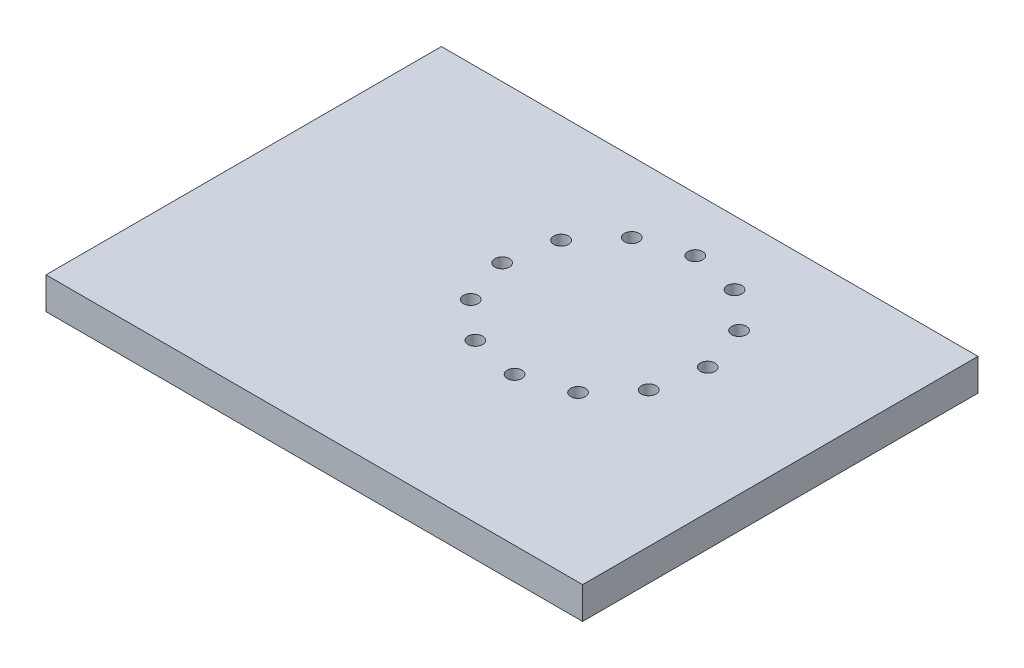
from build123d import *

# Parameters (mm, degrees)
SKETCH1_W           = 241.3
SKETCH1_H           = 177.8
BOSS_EXTRUDE1_DEPTH = 14.351
SKETCH3_R           = 3.3
CUT_EXTRUDE1_DEPTH  = 301.074126177


with BuildPart() as part:
    # Sketch1 → Boss-Extrude1 (new body)
    with BuildSketch(Plane(origin=(0, 0, 0), x_dir=(1, 0, 0), z_dir=(0, 1, 0))):
        with Locations((120.65, 88.9)):
            Rectangle(SKETCH1_W, SKETCH1_H)
    extrude(amount=BOSS_EXTRUDE1_DEPTH)

    # Sketch3 → Cut-Extrude1 (cut, through all)
    with BuildSketch(Plane(origin=(0, 14.351, 0), x_dir=(1, 0, 0), z_dir=(0, 1, 0))):
        with Locations(Location((180.309179647, 90.721597343, 0), (0, 0, 270))):
            Circle(SKETCH3_R)
        with Locations(Location((184.729795286, 112.800660267, 0), (0, 0, 270))):
            Circle(SKETCH3_R)
        with Locations(Location((177.518629268, 134.13199747, 0), (0, 0, 270))):
            Circle(SKETCH3_R)
        with Locations(Location((160.607907704, 148.999894376, 0), (0, 0, 270))):
            Circle(SKETCH3_R)
        with Locations(Location((138.52884478, 153.420510015, 0), (0, 0, 270))):
            Circle(SKETCH3_R)
        with Locations(Location((117.197507577, 146.209343997, 0), (0, 0, 270))):
            Circle(SKETCH3_R)
        with Locations(Location((102.329610671, 129.298622433, 0), (0, 0, 270))):
            Circle(SKETCH3_R)
        with Locations(Location((97.908995032, 107.219559509, 0), (0, 0, 270))):
            Circle(SKETCH3_R)
        with Locations(Location((105.12016105, 85.888222306, 0), (0, 0, 270))):
            Circle(SKETCH3_R)
        with Locations(Location((122.030882614, 71.0203254, 0), (0, 0, 270))):
            Circle(SKETCH3_R)
        with Locations(Location((165.441282741, 73.810875779, 0), (0, 0, 270))):
            Circle(SKETCH3_R)
        with Locations(Location((144.109945538, 66.599709761, 0), (0, 0, 270))):
            Circle(SKETCH3_R)
    extrude(amount=-CUT_EXTRUDE1_DEPTH, mode=Mode.SUBTRACT)


solid = part.part
